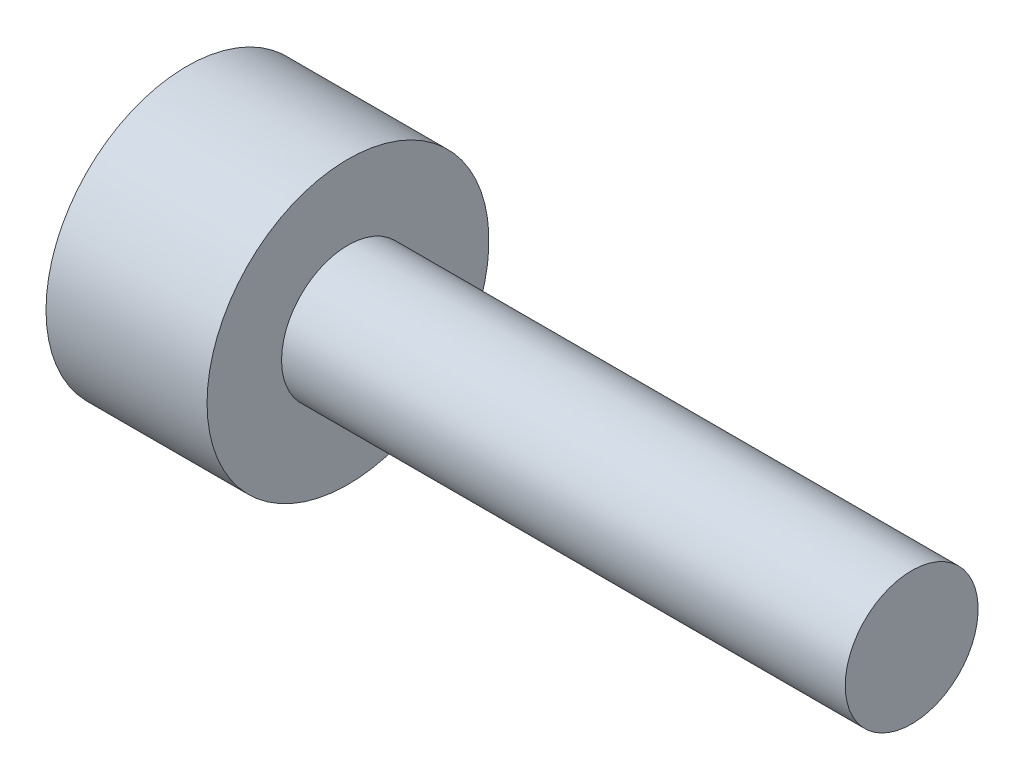
from build123d import *

# Parameters (mm, degrees)
SOCKET_DEPTH = 2


with BuildPart() as part:
    # Screw Sketch → Screw (revolve)
    with BuildSketch(Plane.XY):
        Polygon((-4, 0), (-4, 3.5), (0, 3.5), (0, 1.65), (14, 1.65), (14, 0), align=None)
    revolve(axis=Axis((-1000, 0, 0), (1, 0, 0)))

    # Socket Sketch → Socket (cut)
    with BuildSketch(Plane(origin=(-4, 0, 0), x_dir=(0, 0, -1), z_dir=(1, 0, 0))):
        Polygon((1.732050808, 0), (0.866025404, 1.5), (-0.866025404, 1.5), (-1.732050808, 0), (-0.866025404, -1.5), (0.866025404, -1.5), align=None)
    extrude(amount=SOCKET_DEPTH, mode=Mode.SUBTRACT)


solid = part.part
